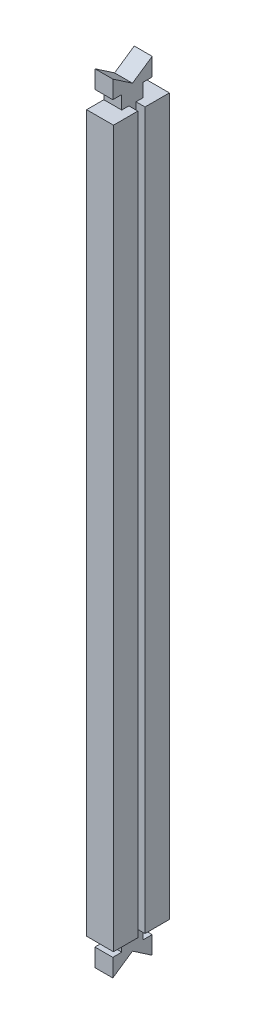
from build123d import *

# Parameters (mm, degrees)
BOSS_EXTRUDE1_DEPTH = 5.08
SKETCH2_W           = 6.9215
SKETCH2_H           = 203.2
BOSS_EXTRUDE2_DEPTH = 2.54


with BuildPart() as part:
    # Sketch1 → Boss-Extrude1 (new body)
    with BuildSketch(Plane(origin=(0, 0, 0), x_dir=(0, 0, -1), z_dir=(1, 0, 0))):
        Polygon((-3.048, 15.875), (-7.9375, 15.875), (-7.9375, 219.075), (-3.048, 219.075), (-3.048, 222.885), (-5.588, 222.885), (-5.588, 227.965), (0, 224.155), (5.588, 227.965), (5.588, 222.885), (3.048, 222.885), (3.048, 219.075), (7.9375, 219.075), (7.9375, 15.875), (3.048, 15.875), (3.048, 12.065), (5.588, 12.065), (5.588, 6.985), (0, 10.795), (-5.588, 6.985), (-5.588, 12.065), (-3.048, 12.065), align=None)
    extrude(amount=BOSS_EXTRUDE1_DEPTH)

    # Sketch2 → Boss-Extrude2 (add)
    with BuildSketch(Plane(origin=(5.08, 0, 0), x_dir=(0, 0, -1), z_dir=(1, 0, 0))):
        with Locations((4.47675, 117.475)):
            Rectangle(SKETCH2_W, SKETCH2_H)
        with Locations((-4.47675, 117.475)):
            Rectangle(SKETCH2_W, SKETCH2_H)
    extrude(amount=BOSS_EXTRUDE2_DEPTH)


solid = part.part
